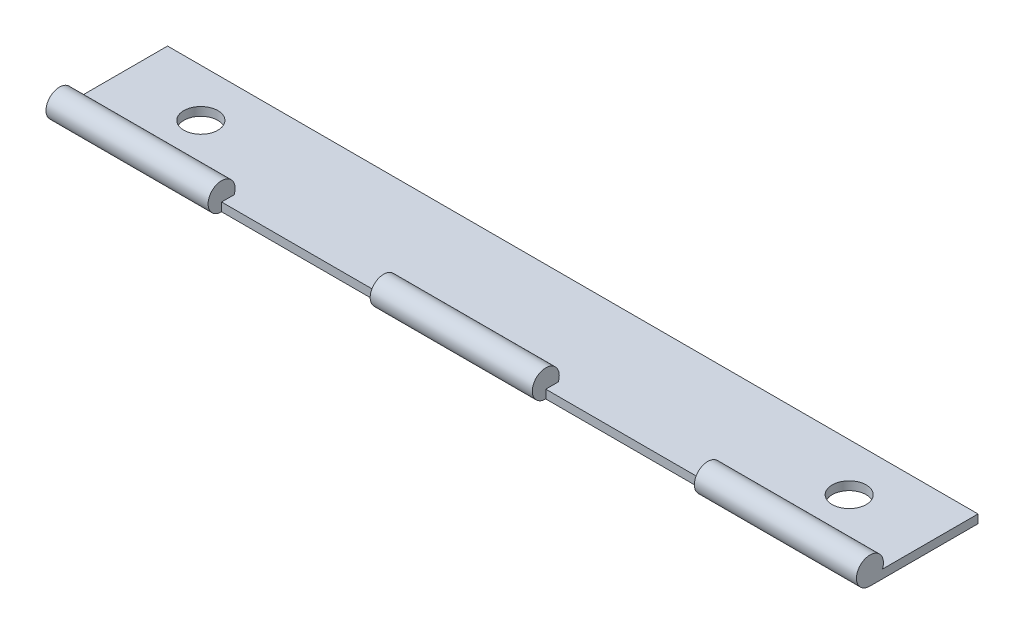
from build123d import *

# Parameters (mm, degrees)
SKETCH1_W               = 38.1
SKETCH1_H               = 12.7
BOSS_EXTRUDE1_DEPTH     = 1
SKETCH2_R               = 1.5875
BOSS_EXTRUDE2_DEPTH     = 19.05
MATRIZL1_COUNT          = 2
MATRIZL1_PITCH          = 38.1
SALIENTE_EXTRUIR1_DEPTH = 19.05
CROQUIS2_R              = 2
CORTAR_EXTRUIR1_DEPTH   = 19.05


with BuildPart() as part:
    # Sketch1 → Boss-Extrude1 (new body)
    with BuildSketch(Plane(origin=(0, 0, 0), x_dir=(1, 0, 0), z_dir=(0, 1, 0))):
        with Locations((19.05, 6.35)):
            Rectangle(SKETCH1_W, SKETCH1_H)
    boss_extrude1 = extrude(amount=BOSS_EXTRUDE1_DEPTH)

    # Sketch2 → Boss-Extrude2 (add)
    with BuildSketch(Plane.ZY):
        with Locations((0, 1.5875)):
            Circle(SKETCH2_R)
    boss_extrude2 = extrude(amount=-BOSS_EXTRUDE2_DEPTH)

    # MatrizL1: Boss-Extrude1, Boss-Extrude2 ×2
    with Locations(*[(i * MATRIZL1_PITCH, 0, 0) for i in range(1, MATRIZL1_COUNT)]):
        add(boss_extrude1)
        add(boss_extrude2)

    # Croquis1 → Saliente-Extruir1 (add)
    with BuildSketch(Plane(origin=(76.2, 0, 0), x_dir=(0, 0, -1), z_dir=(1, 0, 0))):
        with BuildLine():
            Line((12.7, 0), (0, 0))
            ThreePointArc((0, 0), (-0.890926484, 2.901427795), (1.47478812, 1))
            Line((1.47478812, 1), (12.7, 1))
            Line((12.7, 1), (12.7, 0))
        make_face()
    extrude(amount=SALIENTE_EXTRUIR1_DEPTH)

    # Croquis2 → Cortar-Extruir1 (cut)
    with BuildSketch(Plane(origin=(0, 1, 0), x_dir=(1, 0, 0), z_dir=(0, 1, 0))):
        with Locations(Location((85.725, 7.08739406, 0), (0, 0, 270))):
            Circle(CROQUIS2_R)
        with Locations(Location((9.525, 7.08739406, 0), (0, 0, 270))):
            Circle(CROQUIS2_R)
    extrude(amount=-CORTAR_EXTRUIR1_DEPTH, mode=Mode.SUBTRACT)


solid = part.part
